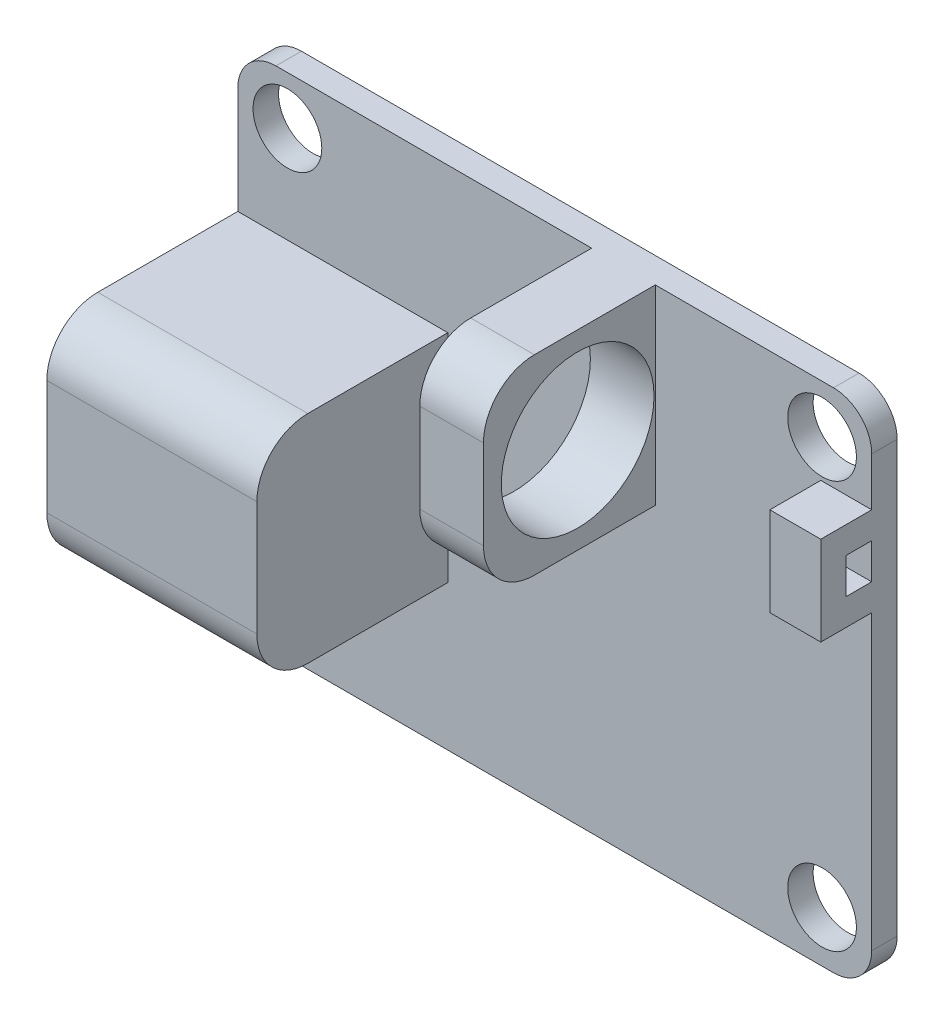
from build123d import *

# Parameters (mm, degrees)
CROQUIS1_W               = 49.8
CROQUIS1_H               = 39.8
CROQUIS1_R               = 2.7
SALIENTE_EXTRUIR1_DEPTH  = 6
CORTAR_EXTRUIR1_DEPTH    = 4
REDONDEO1_R              = 3
SALIENTE_EXTRUIR3_DEPTH  = 3
CROQUIS5_R               = 6.35
CORTAR_EXTRUIR2_DEPTH    = 3
SALIENTE_EXTRUIR4_DEPTH  = 10
SALIENTE_EXTRUIR5_DEPTH  = 2
CORTAR_EXTRUIR3_START    = -3
CORTAR_EXTRUIR3_DEPTH    = 3
CORTAR_EXTRUIR4_DEPTH    = 4
CROQUIS10_W              = 4
CROQUIS10_H              = 7
SALIENTE_EXTRUIR6_DEPTH  = 4
CORTAR_EXTRUIR5_START    = -4
CORTAR_EXTRUIR5_DEPTH    = 4
CROQUIS16_W              = 28.958796265
CROQUIS16_H              = 47.870649268
CORTAR_EXTRUIR6_DEPTH    = 2
CROQUIS17_W              = 5
CROQUIS17_H              = 16
CORTAR_EXTRUIR7_DEPTH    = 10
CORTAR_EXTRUIR8_DEPTH    = 2
SALIENTE_EXTRUIR7_DEPTH  = 2
CROQUIS22_R              = 6.5
SALIENTE_EXTRUIR9_DEPTH  = 15
SALIENTE_EXTRUIR10_DEPTH = 1.5
CROQUIS25_W              = 5
CROQUIS25_H              = 15
SALIENTE_EXTRUIR11_DEPTH = 13.5
CROQUIS26_R              = 6
CORTAR_EXTRUIR9_DEPTH    = 5
REDONDEO2_R              = 4


with BuildPart() as part:
    # Croquis1 → Saliente-Extruir1 (new body)
    with BuildSketch(Plane.XY):
        with Locations((-31.963412372, -3.757931034)):
            Rectangle(CROQUIS1_W, CROQUIS1_H)
        with Locations((-52.963412372, 12.342068966)):
            Circle(CROQUIS1_R, mode=Mode.SUBTRACT)
        with Locations((-10.963412372, 12.342068966)):
            Circle(CROQUIS1_R, mode=Mode.SUBTRACT)
        with Locations((-10.963412372, -19.657931034)):
            Circle(CROQUIS1_R, mode=Mode.SUBTRACT)
        with Locations((-52.963412372, -19.657931034)):
            Circle(CROQUIS1_R, mode=Mode.SUBTRACT)
    extrude(amount=SALIENTE_EXTRUIR1_DEPTH)

    # Croquis2 → Cortar-Extruir1 (cut)
    with BuildSketch(Plane.XY.offset(6)):
        with BuildLine():
            Line((-49.963412372, -16.757931034), (-13.963412372, -16.757931034))
            ThreePointArc((-13.963412372, -16.757931034), (-12.54919881, -16.172144597), (-11.963412372, -14.757931034))
            Line((-11.963412372, -14.757931034), (-11.963412372, 7.242068966))
            ThreePointArc((-11.963412372, 7.242068966), (-12.54919881, 8.656282528), (-13.963412372, 9.242068966))
            Line((-13.963412372, 9.242068966), (-49.963412372, 9.242068966))
            ThreePointArc((-49.963412372, 9.242068966), (-51.377625934, 8.656282528), (-51.963412372, 7.242068966))
            Line((-51.963412372, 7.242068966), (-51.963412372, -14.757931034))
            ThreePointArc((-51.963412372, -14.757931034), (-51.377625934, -16.172144597), (-49.963412372, -16.757931034))
        make_face()
    extrude(amount=-CORTAR_EXTRUIR1_DEPTH, mode=Mode.SUBTRACT)

    # Redondeo1
    redondeo1_edges = [part.edges().sort_by_distance(p)[0] for p in [
        (-56.863412372, 16.142068966, 3),
        (-7.063412372, 16.142068966, 3),
        (-7.063412372, -23.657931034, 3),
        (-56.863412372, -23.657931034, 3),
    ]]
    fillet(redondeo1_edges, radius=REDONDEO1_R)

    # Croquis4 → Saliente-Extruir3 (add)
    with BuildSketch(Plane(origin=(0, 0, 0), x_dir=(-1, 0, 0), z_dir=(0, 0, -1))):
        with BuildLine():
            Line((56.863412372, 4.242068966), (61.863412372, 4.242068966))
            Line((61.863412372, 4.242068966), (61.863412372, -0.257931034))
            Line((61.863412372, -0.257931034), (57.863412372, -0.257931034))
            ThreePointArc((57.863412372, -0.257931034), (57.358118834, -0.294597605), (56.863412372, -0.403829068))
            Line((56.863412372, -0.403829068), (56.863412372, 4.242068966))
        make_face()
        with BuildLine():
            Line((61.863412372, -11.757931034), (56.863412372, -11.757931034))
            Line((56.863412372, -11.757931034), (56.863412372, -7.112033001))
            ThreePointArc((56.863412372, -7.112033001), (57.358118834, -7.221264464), (57.863412372, -7.257931034))
            Line((57.863412372, -7.257931034), (61.863412372, -7.257931034))
            Line((61.863412372, -7.257931034), (61.863412372, -11.757931034))
        make_face()
    extrude(amount=-SALIENTE_EXTRUIR3_DEPTH)

    # Croquis5 → Cortar-Extruir2 (cut)
    with BuildSketch(Plane.XY.offset(3)):
        with Locations((-57.863412372, -3.757931034)):
            Circle(CROQUIS5_R)
    extrude(amount=CORTAR_EXTRUIR2_DEPTH, mode=Mode.SUBTRACT)

    # Croquis6 → Saliente-Extruir4 (add)
    with BuildSketch(Plane.XY.offset(3)):
        with BuildLine():
            Line((-61.863412372, 4.242068966), (-51.963412372, 4.242068966))
            Line((-51.963412372, 4.242068966), (-48.963412372, 4.242068966))
            Line((-48.963412372, 4.242068966), (-48.963412372, -11.757931034))
            Line((-48.963412372, -11.757931034), (-51.963412372, -11.757931034))
            Line((-51.963412372, -11.757931034), (-61.863412372, -11.757931034))
            Line((-61.863412372, -11.757931034), (-61.863412372, -8.689715701))
            ThreePointArc((-61.863412372, -8.689715701), (-51.513412372, -3.757931034), (-61.863412372, 1.173853632))
            Line((-61.863412372, 1.173853632), (-61.863412372, 4.242068966))
        make_face()
    extrude(amount=SALIENTE_EXTRUIR4_DEPTH)

    # Croquis7 → Saliente-Extruir5 (add)
    with BuildSketch(Plane.XY.offset(2)):
        Polygon((-51.963412372, -3.757931034), (-51.963412372, 4.242068966), (-48.963412372, 4.242068966), (-48.963412372, -11.757931034), (-51.963412372, -11.757931034), align=None)
    extrude(amount=SALIENTE_EXTRUIR5_DEPTH)

    # Croquis8 → Cortar-Extruir3 (cut)
    with BuildSketch(Plane.XY.offset(3).offset(CORTAR_EXTRUIR3_START)):
        with BuildLine():
            Line((-56.863412372, -0.403829068), (-56.863412372, -7.112033001))
            ThreePointArc((-56.863412372, -7.112033001), (-53.509310406, -3.757931034), (-56.863412372, -0.403829068))
        make_face()
    extrude(amount=CORTAR_EXTRUIR3_DEPTH, mode=Mode.SUBTRACT)

    # Croquis9 → Cortar-Extruir4 (cut)
    with BuildSketch(Plane.XY.offset(6)):
        Polygon((-56.863412372, -11.757931034), (-56.863412372, -27.492217147), (-1.817084798, -27.492217147), (-1.817084798, 22.861833321), (-56.863412372, 22.861833321), (-56.863412372, 4.242068966), (-47.172737702, 4.242068966), (-47.172737702, -11.757931034), align=None)
    extrude(amount=-CORTAR_EXTRUIR4_DEPTH, mode=Mode.SUBTRACT)

    # Croquis10 → Saliente-Extruir6 (add)
    with BuildSketch(Plane.XY.offset(2)):
        with Locations((-9.063412372, 5.842068966)):
            Rectangle(CROQUIS10_W, CROQUIS10_H)
    extrude(amount=SALIENTE_EXTRUIR6_DEPTH)

    # Croquis11 → Cortar-Extruir5 (cut)
    with BuildSketch(Plane(origin=(-7.063412372, 0, 0), x_dir=(0, 0, -1), z_dir=(1, 0, 0)).offset(CORTAR_EXTRUIR5_START)):
        Polygon((-2, 5.842068966), (-2, 7.242068966), (-4, 7.242068966), (-4, 4.442068966), (-2, 4.442068966), align=None)
    extrude(amount=CORTAR_EXTRUIR5_DEPTH, mode=Mode.SUBTRACT)

    # Croquis16 → Cortar-Extruir6 (cut)
    with BuildSketch(Plane.XY.offset(2)):
        with Locations((-49.718694927, -6.990346687)):
            Rectangle(CROQUIS16_W, CROQUIS16_H)
    extrude(amount=CORTAR_EXTRUIR6_DEPTH, mode=Mode.SUBTRACT)


with BuildPart() as cortar_extruir6_kept_piece:
    # of the separate pieces the step leaves, the one the design keeps (cortar_extruir6_pieces_kept)
    add(part.part.solids().sort_by_distance((-53.863412372, 16.142068966, 0))[0])

    # Croquis17 → Cortar-Extruir7 (cut)
    with BuildSketch(Plane.XY.offset(2)):
        with Locations((-59.363412372, -3.757931034)):
            Rectangle(CROQUIS17_W, CROQUIS17_H)
    extrude(amount=-CORTAR_EXTRUIR7_DEPTH, mode=Mode.SUBTRACT)

    # Croquis18 → Cortar-Extruir8 (cut)
    with BuildSketch(Plane.XY.offset(2)):
        with BuildLine():
            Line((-56.863412372, -0.403829068), (-50.513412372, -0.403829068))
            ThreePointArc((-50.513412372, -0.403829068), (-47.159310406, -3.757931034), (-50.513412372, -7.112033001))
            Line((-50.513412372, -7.112033001), (-56.863412372, -7.112033001))
            Line((-56.863412372, -7.112033001), (-56.863412372, -0.403829068))
        make_face()
    extrude(amount=-CORTAR_EXTRUIR8_DEPTH, mode=Mode.SUBTRACT)

    # Croquis20 → Saliente-Extruir7 (add)
    with BuildSketch(Plane.XY.offset(2)):
        with BuildLine():
            Line((-56.863412372, -0.403829068), (-56.863412372, -7.112033001))
            Line((-56.863412372, -7.112033001), (-50.513412372, -7.112033001))
            ThreePointArc((-50.513412372, -7.112033001), (-47.159310406, -3.757931034), (-50.513412372, -0.403829068))
            Line((-50.513412372, -0.403829068), (-56.863412372, -0.403829068))
        make_face()
    extrude(amount=-SALIENTE_EXTRUIR7_DEPTH)

    # Croquis22 → Saliente-Extruir9 (add)
    with BuildSketch(Plane.ZY.offset(56.863412372)):
        with BuildLine():
            Line((2, -3.757931034), (2, 4.742068966))
            Line((2, 4.742068966), (13, 4.742068966))
            ThreePointArc((13, 4.742068966), (15.828427125, 3.57049609), (17, 0.742068966))
            Line((17, 0.742068966), (17, -8.257931034))
            ThreePointArc((17, -8.257931034), (15.828427125, -11.086358159), (13, -12.257931034))
            Line((13, -12.257931034), (2, -12.257931034))
            Line((2, -12.257931034), (2, -3.757931034))
        make_face()
        with Locations(Location((8.55, -3.757931034, 0), (0, 0, 270))):
            Circle(CROQUIS22_R, mode=Mode.SUBTRACT)
    extrude(amount=-SALIENTE_EXTRUIR9_DEPTH)

    # Croquis23 → Saliente-Extruir10 (add)
    with BuildSketch(Plane(origin=(-41.863412372, 0, 0), x_dir=(0, 0, -1), z_dir=(1, 0, 0))):
        with BuildLine():
            Line((-13, -12.257931034), (-2, -12.257931034))
            Line((-2, -12.257931034), (-2, 4.742068966))
            Line((-2, 4.742068966), (-13, 4.742068966))
            ThreePointArc((-13, 4.742068966), (-15.828427125, 3.57049609), (-17, 0.742068966))
            Line((-17, 0.742068966), (-17, -8.257931034))
            ThreePointArc((-17, -8.257931034), (-15.828427125, -11.086358159), (-13, -12.257931034))
        make_face()
    extrude(amount=SALIENTE_EXTRUIR10_DEPTH)

    # Croquis25 → Saliente-Extruir11 (add)
    with BuildSketch(Plane.XY.offset(2)):
        with Locations((-26.563412372, 8.642068966)):
            Rectangle(CROQUIS25_W, CROQUIS25_H)
    extrude(amount=SALIENTE_EXTRUIR11_DEPTH)

    # Croquis26 → Cortar-Extruir9 (cut)
    with BuildSketch(Plane(origin=(-24.063412372, 0, 0), x_dir=(0, 0, -1), z_dir=(1, 0, 0))):
        with Locations((-8.1, 8.642068966)):
            Circle(CROQUIS26_R)
    extrude(amount=-CORTAR_EXTRUIR9_DEPTH, mode=Mode.SUBTRACT)

    # Redondeo2
    redondeo2_edges = [cortar_extruir6_kept_piece.edges().sort_by_distance(p)[0] for p in [
        (-26.563412372, 1.142068966, 15.5),
        (-26.563412372, 16.142068966, 15.5),
    ]]
    fillet(redondeo2_edges, radius=REDONDEO2_R)


solid = cortar_extruir6_kept_piece.part
